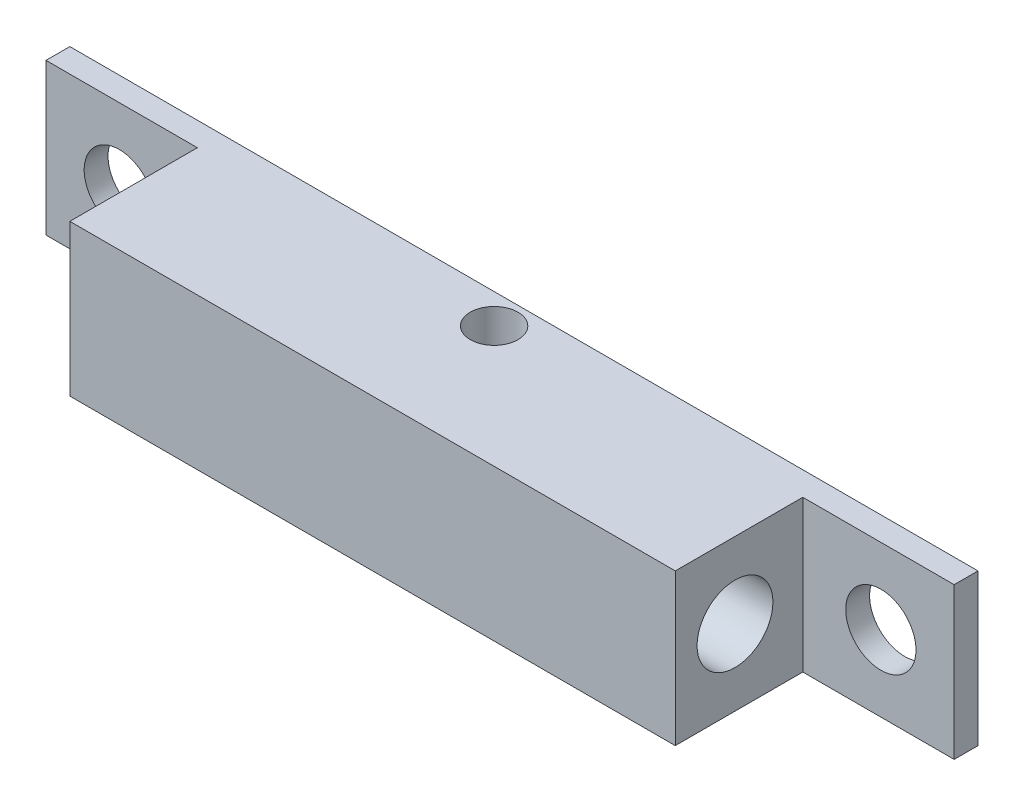
from build123d import *

# Parameters (mm, degrees)
SKETCH1_W             = 6.35
SKETCH1_H             = 6.35
SKETCH1_R             = 1.4732
BOSS_EXTRUDE1_DEPTH   = 1
BOSS_EXTRUDE1_2_DEPTH = 1
SKETCH1_3_W           = 25.4
SKETCH1_3_H           = 6.35
BOSS_EXTRUDE2_DEPTH   = 6.35
SKETCH2_R             = 1.591
CUT_EXTRUDE1_DEPTH    = 25.4
SKETCH3_R             = 1
CUT_EXTRUDE2_DEPTH    = 6.35


with BuildPart() as part:
    # Sketch1 → Boss-Extrude1 (new body)
    with BuildSketch(Plane.XY):
        with Locations((-3.175, -3.175)):
            Rectangle(SKETCH1_W, SKETCH1_H)
        with Locations((-3.275, -3.175)):
            Circle(SKETCH1_R, mode=Mode.SUBTRACT)
    extrude(amount=BOSS_EXTRUDE1_DEPTH)



with BuildPart() as body_2:
    # Sketch1 → Boss-Extrude1 2 (new body)
    with BuildSketch(Plane.XY):
        with Locations((28.575, -3.175)):
            Rectangle(SKETCH1_W, SKETCH1_H)
        with Locations((28.675, -3.175)):
            Circle(SKETCH1_R, mode=Mode.SUBTRACT)
    extrude(amount=BOSS_EXTRUDE1_2_DEPTH)


with BuildPart() as part_1:
    add(part.part)

    add(body_2.part)  # Boss-Extrude2 merges body 2
    # Sketch1<3> → Boss-Extrude2 (add)
    with BuildSketch(Plane.XY):
        with Locations((12.7, -3.175)):
            Rectangle(SKETCH1_3_W, SKETCH1_3_H)
    extrude(amount=BOSS_EXTRUDE2_DEPTH)

    # Sketch2 → Cut-Extrude1 (cut)
    with BuildSketch(Plane.ZY):
        with Locations(Location((3.8448, -3.175, 0), (0, 0, 270))):
            Circle(SKETCH2_R)
    extrude(amount=-CUT_EXTRUDE1_DEPTH, mode=Mode.SUBTRACT)

    # Sketch3 → Cut-Extrude2 (cut)
    with BuildSketch(Plane(origin=(0, 0, 0), x_dir=(1, 0, 0), z_dir=(0, 1, 0))):
        with Locations(Location((12.7, -1.25, 0), (0, 0, 270))):
            Circle(SKETCH3_R)
    extrude(amount=-CUT_EXTRUDE2_DEPTH, mode=Mode.SUBTRACT)


solid = part_1.part
